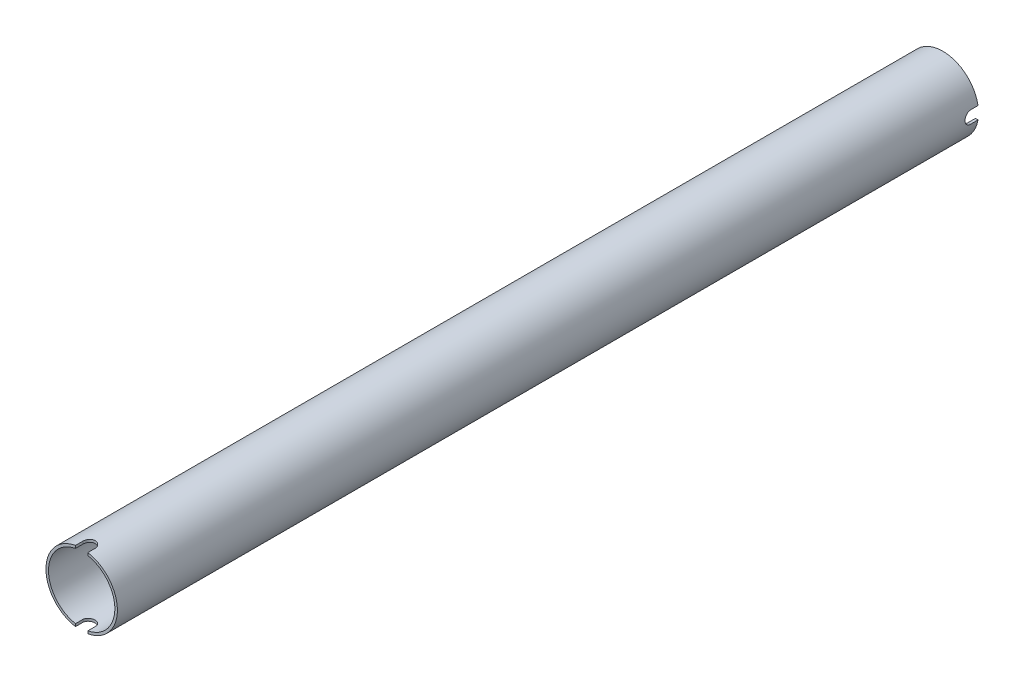
from build123d import *

# Parameters (mm, degrees)
SKETCH1_W          = 300.0375
SKETCH1_H          = 0.889
CUT_EXTRUDE1_DEPTH = 12.7
CUT_EXTRUDE2_DEPTH = 12.7
SCALE1_SCALE       = 0.6


with BuildPart() as part:
    # Sketch1 → Revolve1 (revolve)
    with BuildSketch(Plane(origin=(0, 0, 0), x_dir=(0, 0, -1), z_dir=(1, 0, 0)), mode=Mode.PRIVATE) as revolve1_sk:
        with Locations((0, 12.0015)):
            Rectangle(SKETCH1_W, SKETCH1_H)
    revolve(revolve1_sk.sketch.rotate(Axis((0, 0, 90.675886036), (0, 0, -1)), 90), axis=Axis((0, 0, 90.675886036), (0, 0, -1)))

    # Sketch2 → Cut-Extrude1 (cut, symmetric)
    with BuildSketch(Plane(origin=(0, 0, 0), x_dir=(1, 0, 0), z_dir=(0, 1, 0))):
        with BuildLine():
            Line((-2.159, -155.09875), (-2.159, -147.47875))
            ThreePointArc((-2.159, -147.47875), (0, -145.31975), (2.159, -147.47875))
            Line((2.159, -147.47875), (2.159, -155.09875))
            ThreePointArc((2.159, -155.09875), (0, -157.25775), (-2.159, -155.09875))
        make_face()
    extrude(amount=CUT_EXTRUDE1_DEPTH, both=True, mode=Mode.SUBTRACT)

    # Sketch3 → Cut-Extrude2 (cut, symmetric)
    with BuildSketch(Plane(origin=(0, 0, 0), x_dir=(0, 0, -1), z_dir=(1, 0, 0))):
        with BuildLine():
            Line((155.09875, -2.159), (147.47875, -2.159))
            ThreePointArc((147.47875, -2.159), (145.31975, 0), (147.47875, 2.159))
            Line((147.47875, 2.159), (155.09875, 2.159))
            ThreePointArc((155.09875, 2.159), (157.25775, 0), (155.09875, -2.159))
        make_face()
    extrude(amount=CUT_EXTRUDE2_DEPTH, both=True, mode=Mode.SUBTRACT)


with BuildPart() as part_1:
    # Scale1: scaled about (-1.267e-06, -7.59e-07, -4.795e-06)
    add(part.part.scale(SCALE1_SCALE).moved(Location((-5.07e-07, -3.04e-07, -1.918e-06))))


solid = part_1.part
